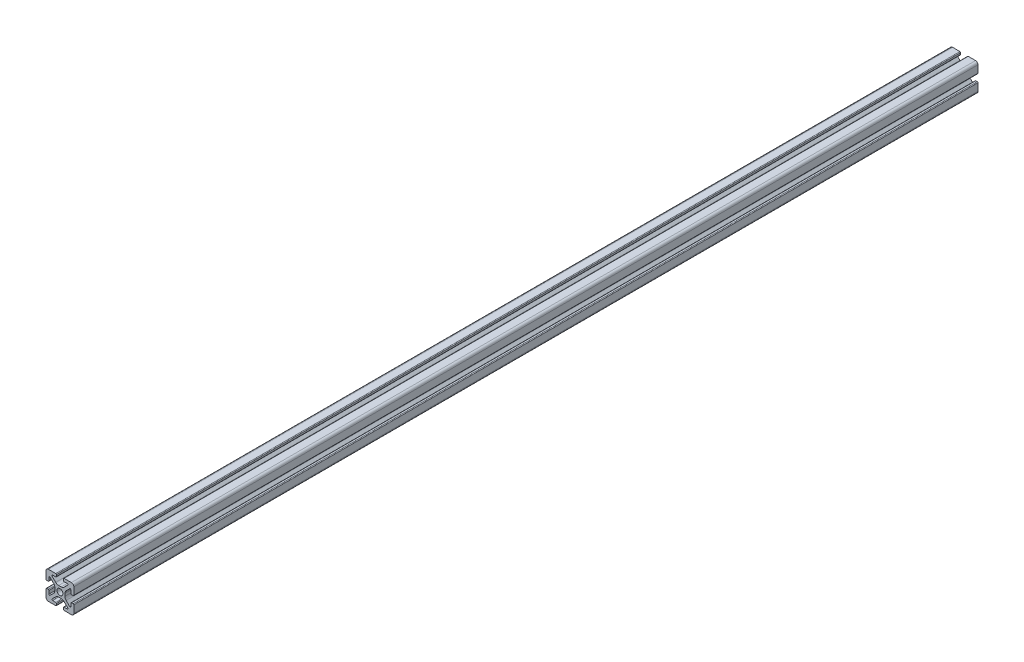
from build123d import *

# Parameters (mm, degrees)
BOSS_EXTRUDE1_DEPTH = 325


with BuildPart() as part:
    # Sketch4 → Boss-Extrude1 (new, symmetric)
    with BuildSketch(Plane.XY):
        with BuildLine():
            Line((3, -10), (8.25, -10))
            ThreePointArc((8.25, -10), (9.487436867, -9.487436867), (10, -8.25))
            Line((10, -8.25), (10, -3))
            ThreePointArc((10, -3), (9.853553391, -2.646446609), (9.5, -2.5))
            Line((9.5, -2.5), (8.424621202, -2.5))
            ThreePointArc((8.424621202, -2.5), (8.071067812, -2.646446609), (7.924621202, -3))
            Line((7.924621202, -3), (7.924621202, -5.25))
            ThreePointArc((7.924621202, -5.25), (7.615962919, -5.711939766), (7.071067812, -5.603553391))
            Line((7.071067812, -5.603553391), (4.478679656, -3.011165235))
            ThreePointArc((4.478679656, -3.011165235), (3.828361402, -2.037895189), (3.6, -0.889844892))
            Line((3.6, -0.889844892), (3.6, 0))
            Line((3.6, 0), (2.15, 0))
            ThreePointArc((2.15, 0), (1.52027958, -1.52027958), (0, -2.15))
            Line((0, -2.15), (0, -3.6))
            Line((0, -3.6), (0.889844892, -3.6))
            ThreePointArc((0.889844892, -3.6), (2.037895189, -3.828361402), (3.011165235, -4.478679656))
            Line((3.011165235, -4.478679656), (5.603553391, -7.071067812))
            ThreePointArc((5.603553391, -7.071067812), (5.711939766, -7.615962919), (5.25, -7.924621202))
            Line((5.25, -7.924621202), (3, -7.924621202))
            ThreePointArc((3, -7.924621202), (2.646446609, -8.071067812), (2.5, -8.424621202))
            Line((2.5, -8.424621202), (2.5, -9.5))
            ThreePointArc((2.5, -9.5), (2.646446609, -9.853553391), (3, -10))
        make_face()
    extrude(amount=BOSS_EXTRUDE1_DEPTH, both=True)

    # Mirror1: part across plane


with BuildPart() as part_1:
    add(part.part)
    add(part.part.mirror(Plane(origin=(0, 0, 0), x_dir=(0, 0, 1), z_dir=(1, 0, 0))))

    # Mirror2: part across plane


with BuildPart() as part_2:
    add(part_1.part)
    add(part_1.part.mirror(Plane.ZX))


solid = part_2.part
